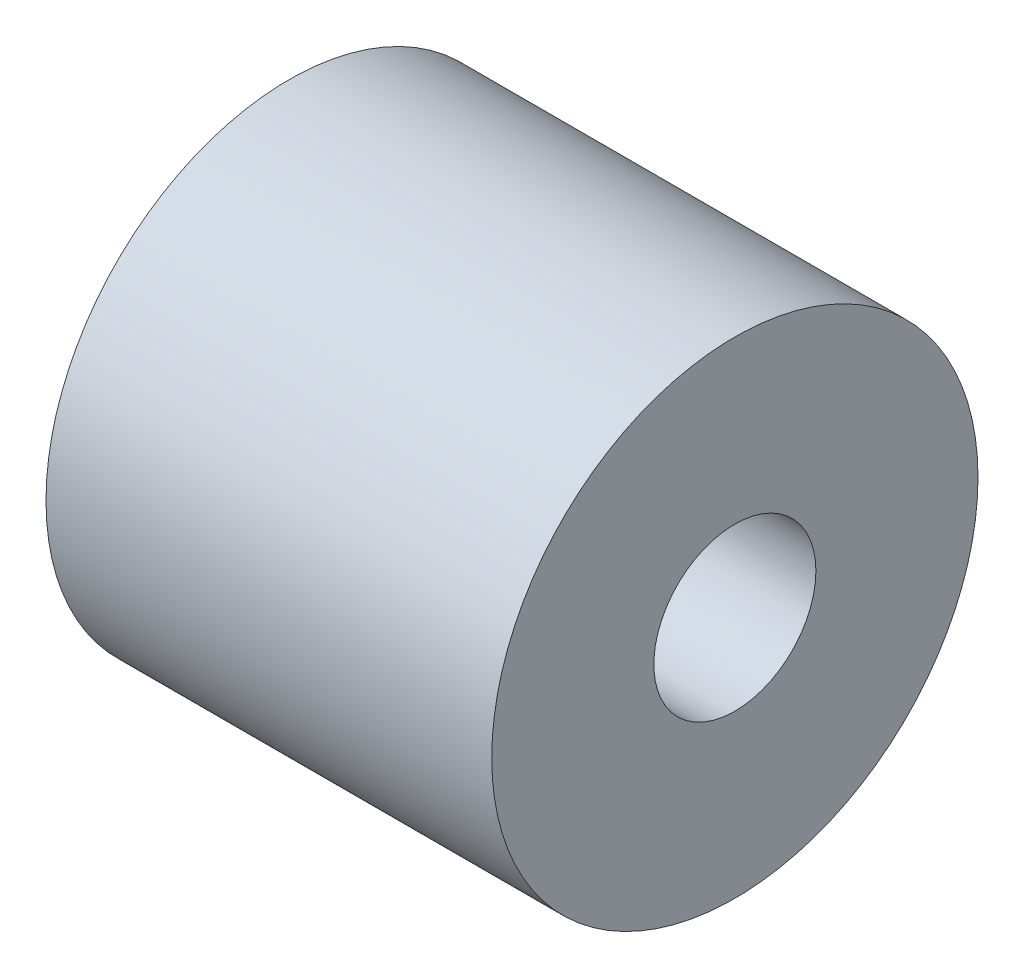
from build123d import *

# Parameters (mm, degrees)
ESQUISSE1_R        = 1
BOSS_EXTRU_1_DEPTH = 5.5
BOSS_EXTRU_2_START = -5.5
ESQUISSE2_R        = 3
ESQUISSE2_R_2      = 1
BOSS_EXTRU_2_DEPTH = 5.5


with BuildPart() as part:
    # Esquisse1 → Boss.-Extru.1 (new body)
    with BuildSketch(Plane(origin=(0, 0, 0), x_dir=(0, 0, -1), z_dir=(1, 0, 0))):
        with BuildLine():
            ThreePointArc((2.977310095, 0.368272455), (2.955741127, 0.513414445), (2.927100903, 0.657328154))
            add(Edge.make_bspline(
                [(2.211403727, 0.79214554), (2.222779445, 0.796220429), (2.274133198, 0.805614359), (2.359373738, 0.810478726), (2.538607422, 0.796225963), (2.732062921, 0.744216047), (2.878239296, 0.681280138), (2.927100903, 0.657328154)],
                knots=[0, 0, 0, 0, 0.036250587, 0.155621312, 0.255291203, 0.575254513, 0.744084786, 0.744084786, 0.744084786, 0.744084786], degree=3))
            add(Edge.make_bspline(
                [(2.211403727, 0.79214554), (2.132130324, 0.763749064), (1.99001212, 0.681956821), (1.750090704, 0.694113528), (1.707279056, 0.775127876)],
                knots=[0, 0, 0, 0, 0.252617676, 0.527509393, 0.527509393, 0.527509393, 0.527509393], degree=3))
            ThreePointArc((1.707279056, 0.775127876), (1.657764419, 0.876037746), (1.602292085, 0.973799299))
            add(Edge.make_bspline(
                [(1.90038092, 1.380707558), (1.832256922, 1.331212576), (1.684611138, 1.259880414), (1.559480437, 1.054813647), (1.602292085, 0.973799299)],
                knots=[0, 0, 0, 0, 0.252617676, 0.527509393, 0.527509393, 0.527509393, 0.527509393], degree=3))
            add(Edge.make_bspline(
                [(1.90038092, 1.380707558), (1.9101567, 1.387810078), (1.946851003, 1.424944725), (1.998895263, 1.49262786), (2.088102134, 1.648736761), (2.154127637, 1.837868182), (2.184488772, 1.994094501), (2.192229346, 2.04795764)],
                knots=[0, 0, 0, 0, 0.036250587, 0.155621312, 0.255291203, 0.575254513, 0.744084786, 0.744084786, 0.744084786, 0.744084786], degree=3))
            ThreePointArc((2.192229346, 2.04795764), (2.089467363, 2.152702055), (1.98170658, 2.25229639))
            add(Edge.make_bspline(
                [(1.32345173, 1.940689701), (1.33025972, 1.950672835), (1.366284165, 1.988457663), (1.432386008, 2.04249615), (1.585766668, 2.136316339), (1.772846116, 2.207949723), (1.928098087, 2.242953821), (1.98170658, 2.25229639)],
                knots=[0, 0, 0, 0, 0.036250587, 0.155621312, 0.255291203, 0.575254513, 0.744084786, 0.744084786, 0.744084786, 0.744084786], degree=3))
            add(Edge.make_bspline(
                [(1.32345173, 1.940689701), (1.27600923, 1.871120733), (1.209109462, 1.721414433), (1.007863426, 1.590227146), (0.925609036, 1.630605075)],
                knots=[0, 0, 0, 0, 0.252617676, 0.527509393, 0.527509393, 0.527509393, 0.527509393], degree=3))
            ThreePointArc((0.925609036, 1.630605075), (0.82623752, 1.683138901), (0.72389666, 1.729623839))
            add(Edge.make_bspline(
                [(0.72588092, 2.234031757), (0.699859868, 2.153947194), (0.622339913, 2.009454248), (0.641642271, 1.770001768), (0.72389666, 1.729623839)],
                knots=[0, 0, 0, 0, 0.252617676, 0.527509393, 0.527509393, 0.527509393, 0.527509393], degree=3))
            add(Edge.make_bspline(
                [(0.72588092, 2.234031757), (0.729614936, 2.245523876), (0.737474053, 2.297134806), (0.739795594, 2.382482461), (0.720206959, 2.561211698), (0.662454053, 2.753031049), (0.595189201, 2.897266624), (0.569791499, 2.945392614)],
                knots=[0, 0, 0, 0, 0.036250587, 0.155621312, 0.255291203, 0.575254513, 0.744084786, 0.744084786, 0.744084786, 0.744084786], degree=3))
            ThreePointArc((0.569791499, 2.945392614), (0.425088085, 2.969730648), (0.279367699, 2.986963958))
            add(Edge.make_bspline(
                [(-0.070013845, 2.347956359), (-0.070374004, 2.360034519), (-0.063438981, 2.411777724), (-0.041724492, 2.494349468), (0.027216945, 2.660406485), (0.136462351, 2.82832165), (0.241488941, 2.947895379), (0.279367699, 2.986963958)],
                knots=[0, 0, 0, 0, 0.036250587, 0.155621312, 0.255291203, 0.575254513, 0.744084786, 0.744084786, 0.744084786, 0.744084786], degree=3))
            add(Edge.make_bspline(
                [(-0.070013845, 2.347956359), (-0.06750402, 2.263787878), (-0.033631914, 2.103350241), (-0.119333425, 1.878928045), (-0.209612175, 1.863246558)],
                knots=[0, 0, 0, 0, 0.252617676, 0.527509393, 0.527509393, 0.527509393, 0.527509393], degree=3))
            ThreePointArc((-0.209612175, 1.863246558), (-0.320884028, 1.847338204), (-0.431002684, 1.824790861))
            add(Edge.make_bspline(
                [(-0.72588092, 2.234031757), (-0.699859868, 2.153947194), (-0.677644007, 1.991484859), (-0.521281435, 1.809109374), (-0.431002684, 1.824790861)],
                knots=[0, 0, 0, 0, 0.252617676, 0.527509393, 0.527509393, 0.527509393, 0.527509393], degree=3))
            add(Edge.make_bspline(
                [(-0.72588092, 2.234031757), (-0.729614936, 2.245523876), (-0.75359292, 2.291897469), (-0.801880846, 2.36230974), (-0.922782795, 2.495390819), (-1.082254463, 2.616629628), (-1.221452415, 2.693781371), (-1.270287335, 2.717787719)],
                knots=[0, 0, 0, 0, 0.036250587, 0.155621312, 0.255291203, 0.575254513, 0.744084786, 0.744084786, 0.744084786, 0.744084786], degree=3))
            ThreePointArc((-1.270287335, 2.717787719), (-1.401660393, 2.65242307), (-1.529680147, 2.580712818))
            add(Edge.make_bspline(
                [(-1.436736511, 1.858383491), (-1.44412725, 1.867943232), (-1.468930592, 1.913880668), (-1.499897654, 1.993446068), (-1.541728726, 2.168311777), (-1.552045394, 2.368370838), (-1.537360771, 2.526841097), (-1.529680147, 2.580712818)],
                knots=[0, 0, 0, 0, 0.036250587, 0.155621312, 0.255291203, 0.575254513, 0.744084786, 0.744084786, 0.744084786, 0.744084786], degree=3))
            add(Edge.make_bspline(
                [(-1.436736511, 1.858383491), (-1.385233029, 1.791764998), (-1.263527042, 1.681877747), (-1.200948963, 1.449942292), (-1.26476866, 1.384191185)],
                knots=[0, 0, 0, 0, 0.252617676, 0.527509393, 0.527509393, 0.527509393, 0.527509393], degree=3))
            ThreePointArc((-1.26476866, 1.384191185), (-1.345438785, 1.305917102), (-1.421273653, 1.222949796))
            add(Edge.make_bspline(
                [(-1.90038092, 1.380707558), (-1.832256922, 1.331212576), (-1.718790948, 1.212835941), (-1.48509335, 1.157198689), (-1.421273653, 1.222949796)],
                knots=[0, 0, 0, 0, 0.252617676, 0.527509393, 0.527509393, 0.527509393, 0.527509393], degree=3))
            add(Edge.make_bspline(
                [(-1.90038092, 1.380707558), (-1.9101567, 1.387810078), (-1.956813011, 1.411233197), (-2.037266059, 1.43981499), (-2.213300886, 1.476415463), (-2.413578559, 1.480764624), (-2.571540724, 1.461363192), (-2.625159582, 1.45208029)],
                knots=[0, 0, 0, 0, 0.036250587, 0.155621312, 0.255291203, 0.575254513, 0.744084786, 0.744084786, 0.744084786, 0.744084786], degree=3))
            ThreePointArc((-2.625159582, 1.45208029), (-2.693022242, 1.321980032), (-2.75444217, 1.188717096))
            add(Edge.make_bspline(
                [(-2.254674663, 0.658971294), (-2.266272971, 0.662361119), (-2.313340644, 0.684946248), (-2.385160892, 0.731114025), (-2.521786425, 0.847995669), (-2.64772455, 1.003782864), (-2.728990923, 1.140619401), (-2.75444217, 1.188717096)],
                knots=[0, 0, 0, 0, 0.036250587, 0.155621312, 0.255291203, 0.575254513, 0.744084786, 0.744084786, 0.744084786, 0.744084786], degree=3))
            add(Edge.make_bspline(
                [(-2.254674663, 0.658971294), (-2.173850103, 0.635348788), (-2.010797786, 0.617985118), (-1.823842817, 0.467127866), (-1.836826505, 0.376421826)],
                knots=[0, 0, 0, 0, 0.252617676, 0.527509393, 0.527509393, 0.527509393, 0.527509393], degree=3))
            ThreePointArc((-1.836826505, 0.376421826), (-1.856081655, 0.265680053), (-1.868666393, 0.153983476))
            add(Edge.make_bspline(
                [(-2.349, 0), (-2.264794108, 0), (-2.103418166, -0.029075083), (-1.881650081, 0.063277436), (-1.868666393, 0.153983476)],
                knots=[0, 0, 0, 0, 0.252617676, 0.527509393, 0.527509393, 0.527509393, 0.527509393], degree=3))
            add(Edge.make_bspline(
                [(-2.349, 0), (-2.361083529, 0), (-2.412597041, -0.00847419), (-2.494484881, -0.032640149), (-2.658413265, -0.106500419), (-2.822997679, -0.220702136), (-2.93938788, -0.329246056), (-2.977310095, -0.368272455)],
                knots=[0, 0, 0, 0, 0.036250587, 0.155621312, 0.255291203, 0.575254513, 0.744084786, 0.744084786, 0.744084786, 0.744084786], degree=3))
            ThreePointArc((-2.977310095, -0.368272455), (-2.955741127, -0.513414445), (-2.927100903, -0.657328154))
            add(Edge.make_bspline(
                [(-2.211403727, -0.79214554), (-2.222779445, -0.796220429), (-2.274133198, -0.805614359), (-2.359373738, -0.810478726), (-2.538607422, -0.796225963), (-2.732062921, -0.744216047), (-2.878239296, -0.681280138), (-2.927100903, -0.657328154)],
                knots=[0, 0, 0, 0, 0.036250587, 0.155621312, 0.255291203, 0.575254513, 0.744084786, 0.744084786, 0.744084786, 0.744084786], degree=3))
            add(Edge.make_bspline(
                [(-2.211403727, -0.79214554), (-2.132130324, -0.763749064), (-1.99001212, -0.681956821), (-1.750090704, -0.694113528), (-1.707279056, -0.775127876)],
                knots=[0, 0, 0, 0, 0.252617676, 0.527509393, 0.527509393, 0.527509393, 0.527509393], degree=3))
            ThreePointArc((-1.707279056, -0.775127876), (-1.657764419, -0.876037746), (-1.602292085, -0.973799299))
            add(Edge.make_bspline(
                [(-1.90038092, -1.380707558), (-1.832256922, -1.331212576), (-1.684611138, -1.259880414), (-1.559480437, -1.054813647), (-1.602292085, -0.973799299)],
                knots=[0, 0, 0, 0, 0.252617676, 0.527509393, 0.527509393, 0.527509393, 0.527509393], degree=3))
            add(Edge.make_bspline(
                [(-1.90038092, -1.380707558), (-1.9101567, -1.387810078), (-1.946851003, -1.424944725), (-1.998895263, -1.49262786), (-2.088102134, -1.648736761), (-2.154127637, -1.837868182), (-2.184488772, -1.994094501), (-2.192229346, -2.04795764)],
                knots=[0, 0, 0, 0, 0.036250587, 0.155621312, 0.255291203, 0.575254513, 0.744084786, 0.744084786, 0.744084786, 0.744084786], degree=3))
            ThreePointArc((-2.192229346, -2.04795764), (-2.089467363, -2.152702055), (-1.98170658, -2.25229639))
            add(Edge.make_bspline(
                [(-1.32345173, -1.940689701), (-1.33025972, -1.950672835), (-1.366284165, -1.988457663), (-1.432386008, -2.04249615), (-1.585766668, -2.136316339), (-1.772846116, -2.207949723), (-1.928098087, -2.242953821), (-1.98170658, -2.25229639)],
                knots=[0, 0, 0, 0, 0.036250587, 0.155621312, 0.255291203, 0.575254513, 0.744084786, 0.744084786, 0.744084786, 0.744084786], degree=3))
            add(Edge.make_bspline(
                [(-1.32345173, -1.940689701), (-1.27600923, -1.871120733), (-1.209109462, -1.721414433), (-1.007863426, -1.590227146), (-0.925609036, -1.630605075)],
                knots=[0, 0, 0, 0, 0.252617676, 0.527509393, 0.527509393, 0.527509393, 0.527509393], degree=3))
            ThreePointArc((-0.925609036, -1.630605075), (-0.82623752, -1.683138901), (-0.72389666, -1.729623839))
            add(Edge.make_bspline(
                [(-0.72588092, -2.234031757), (-0.699859868, -2.153947194), (-0.622339913, -2.009454248), (-0.641642271, -1.770001768), (-0.72389666, -1.729623839)],
                knots=[0, 0, 0, 0, 0.252617676, 0.527509393, 0.527509393, 0.527509393, 0.527509393], degree=3))
            add(Edge.make_bspline(
                [(-0.72588092, -2.234031757), (-0.729614936, -2.245523876), (-0.737474053, -2.297134806), (-0.739795594, -2.382482461), (-0.720206959, -2.561211698), (-0.662454053, -2.753031049), (-0.595189201, -2.897266624), (-0.569791499, -2.945392614)],
                knots=[0, 0, 0, 0, 0.036250587, 0.155621312, 0.255291203, 0.575254513, 0.744084786, 0.744084786, 0.744084786, 0.744084786], degree=3))
            ThreePointArc((-0.569791499, -2.945392614), (-0.425088085, -2.969730648), (-0.279367699, -2.986963958))
            add(Edge.make_bspline(
                [(0.070013845, -2.347956359), (0.070374004, -2.360034519), (0.063438981, -2.411777724), (0.041724492, -2.494349468), (-0.027216945, -2.660406485), (-0.136462351, -2.82832165), (-0.241488941, -2.947895379), (-0.279367699, -2.986963958)],
                knots=[0, 0, 0, 0, 0.036250587, 0.155621312, 0.255291203, 0.575254513, 0.744084786, 0.744084786, 0.744084786, 0.744084786], degree=3))
            add(Edge.make_bspline(
                [(0.070013845, -2.347956359), (0.06750402, -2.263787879), (0.033631914, -2.103350241), (0.119333425, -1.878928045), (0.209612175, -1.863246558)],
                knots=[0, 0, 0, 0, 0.252617676, 0.527509393, 0.527509393, 0.527509393, 0.527509393], degree=3))
            ThreePointArc((0.209612175, -1.863246558), (0.320884028, -1.847338204), (0.431002684, -1.824790861))
            add(Edge.make_bspline(
                [(0.72588092, -2.234031757), (0.699859868, -2.153947194), (0.677644007, -1.991484859), (0.521281435, -1.809109374), (0.431002684, -1.824790861)],
                knots=[0, 0, 0, 0, 0.252617676, 0.527509393, 0.527509393, 0.527509393, 0.527509393], degree=3))
            add(Edge.make_bspline(
                [(0.72588092, -2.234031757), (0.729614936, -2.245523876), (0.75359292, -2.291897469), (0.801880846, -2.36230974), (0.922782795, -2.495390819), (1.082254463, -2.616629628), (1.221452415, -2.693781371), (1.270287335, -2.717787719)],
                knots=[0, 0, 0, 0, 0.036250587, 0.155621312, 0.255291203, 0.575254513, 0.744084786, 0.744084786, 0.744084786, 0.744084786], degree=3))
            ThreePointArc((1.270287335, -2.717787719), (1.401660393, -2.65242307), (1.529680147, -2.580712818))
            add(Edge.make_bspline(
                [(1.436736511, -1.858383491), (1.44412725, -1.867943232), (1.468930592, -1.913880668), (1.499897654, -1.993446068), (1.541728726, -2.168311777), (1.552045394, -2.368370838), (1.537360771, -2.526841097), (1.529680147, -2.580712818)],
                knots=[0, 0, 0, 0, 0.036250587, 0.155621312, 0.255291203, 0.575254513, 0.744084786, 0.744084786, 0.744084786, 0.744084786], degree=3))
            add(Edge.make_bspline(
                [(1.436736511, -1.858383491), (1.385233029, -1.791764998), (1.263527042, -1.681877747), (1.200948963, -1.449942292), (1.26476866, -1.384191185)],
                knots=[0, 0, 0, 0, 0.252617676, 0.527509393, 0.527509393, 0.527509393, 0.527509393], degree=3))
            ThreePointArc((1.26476866, -1.384191185), (1.345438785, -1.305917102), (1.421273653, -1.222949796))
            add(Edge.make_bspline(
                [(1.90038092, -1.380707558), (1.832256922, -1.331212576), (1.718790948, -1.212835941), (1.48509335, -1.157198689), (1.421273653, -1.222949796)],
                knots=[0, 0, 0, 0, 0.252617676, 0.527509393, 0.527509393, 0.527509393, 0.527509393], degree=3))
            add(Edge.make_bspline(
                [(1.90038092, -1.380707558), (1.9101567, -1.387810078), (1.956813011, -1.411233197), (2.037266059, -1.43981499), (2.213300886, -1.476415463), (2.413578559, -1.480764624), (2.571540724, -1.461363192), (2.625159582, -1.45208029)],
                knots=[0, 0, 0, 0, 0.036250587, 0.155621312, 0.255291203, 0.575254513, 0.744084786, 0.744084786, 0.744084786, 0.744084786], degree=3))
            ThreePointArc((2.625159582, -1.45208029), (2.693022242, -1.321980032), (2.75444217, -1.188717096))
            add(Edge.make_bspline(
                [(2.254674663, -0.658971294), (2.266272971, -0.662361119), (2.313340644, -0.684946248), (2.385160892, -0.731114025), (2.521786425, -0.847995669), (2.64772455, -1.003782864), (2.728990923, -1.140619401), (2.75444217, -1.188717096)],
                knots=[0, 0, 0, 0, 0.036250587, 0.155621312, 0.255291203, 0.575254513, 0.744084786, 0.744084786, 0.744084786, 0.744084786], degree=3))
            add(Edge.make_bspline(
                [(2.254674663, -0.658971294), (2.173850103, -0.635348788), (2.010797786, -0.617985118), (1.823842817, -0.467127866), (1.836826505, -0.376421826)],
                knots=[0, 0, 0, 0, 0.252617676, 0.527509393, 0.527509393, 0.527509393, 0.527509393], degree=3))
            ThreePointArc((1.836826505, -0.376421826), (1.856081655, -0.265680053), (1.868666393, -0.153983476))
            add(Edge.make_bspline(
                [(2.349, 0), (2.264794108, 0), (2.103418166, 0.029075083), (1.881650081, -0.063277436), (1.868666393, -0.153983476)],
                knots=[0, 0, 0, 0, 0.252617676, 0.527509393, 0.527509393, 0.527509393, 0.527509393], degree=3))
            add(Edge.make_bspline(
                [(2.349, 0), (2.361083529, 0), (2.412597041, 0.00847419), (2.494484881, 0.032640149), (2.658413265, 0.106500419), (2.822997679, 0.220702136), (2.93938788, 0.329246056), (2.977310095, 0.368272455)],
                knots=[0, 0, 0, 0, 0.036250587, 0.155621312, 0.255291203, 0.575254513, 0.744084786, 0.744084786, 0.744084786, 0.744084786], degree=3))
        make_face()
        Circle(ESQUISSE1_R, mode=Mode.SUBTRACT)
    extrude(amount=BOSS_EXTRU_1_DEPTH)

    # Esquisse2 → Boss.-Extru.2 (add)
    with BuildSketch(Plane(origin=(5.5, 0, 0), x_dir=(0, 0, -1), z_dir=(1, 0, 0)).offset(BOSS_EXTRU_2_START)):
        Circle(ESQUISSE2_R)
        Circle(ESQUISSE2_R_2, mode=Mode.SUBTRACT)
    extrude(amount=BOSS_EXTRU_2_DEPTH)


solid = part.part
